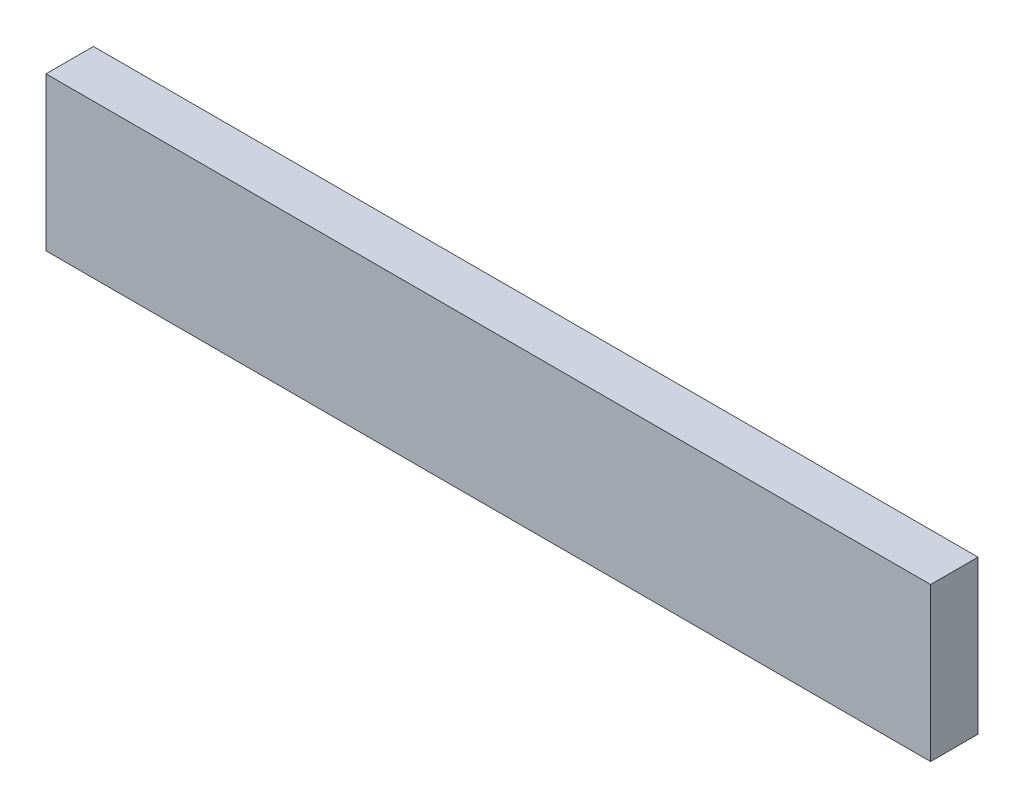
from build123d import *

# Parameters (mm, degrees)
SKETCH1_W           = 55.9596
SKETCH1_H           = 9.7
BOSS_EXTRUDE1_DEPTH = 3


with BuildPart() as part:
    # Sketch1 → Boss-Extrude1 (new body)
    with BuildSketch(Plane.XY):
        Rectangle(SKETCH1_W, SKETCH1_H)
    extrude(amount=BOSS_EXTRUDE1_DEPTH)


solid = part.part
